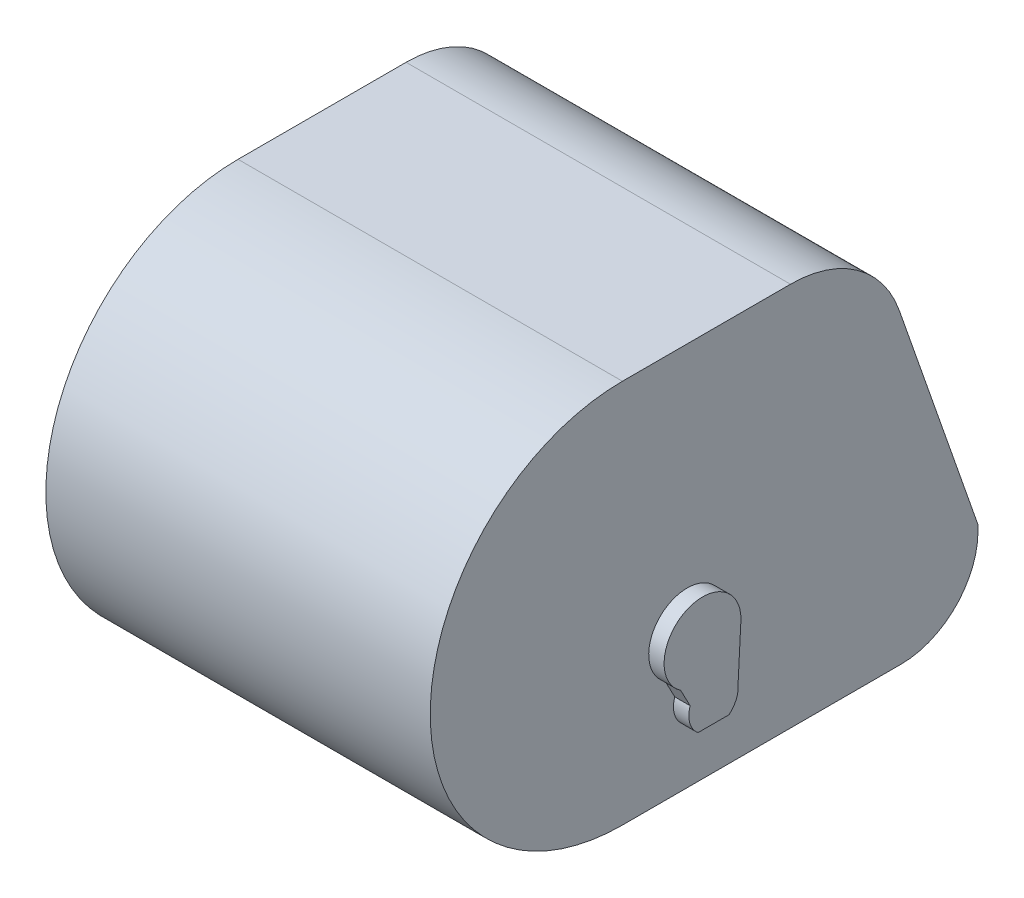
from build123d import *

# Parameters (mm, degrees)
BOSS_EXTRUDE1_DEPTH      = 50
BOSS_EXTRUDE1_DEPTH_BACK = 50
FILLET1_R                = 30
BOSS_EXTRUDE2_DEPTH      = 4
FILLET4_R                = 20


with BuildPart() as part:
    # Sketch1 → Boss-Extrude1 (new, two sides: drawn at the far end of the back side and taken through both)
    with BuildSketch(Plane(origin=(0, 0, 0), x_dir=(0, 0, -1), z_dir=(1, 0, 0)).offset(-BOSS_EXTRUDE1_DEPTH_BACK)):
        with BuildLine():
            Line((67.5, -28.571428571), (40, 50))
            Line((40, 50), (-25.000000097, 50))
            ThreePointArc((-25.000000097, 50), (-75, -6.7e-08), (-24.999999963, -50))
            Line((-24.999999963, -50), (67.5, -50))
            Line((67.5, -50), (67.5, -28.571428571))
        make_face()
    extrude(amount=BOSS_EXTRUDE1_DEPTH + BOSS_EXTRUDE1_DEPTH_BACK)

    # Fillet1
    fillet1_edges = [part.edges().sort_by_distance(p)[0] for p in [
        (0, 50, -40),
    ]]
    fillet(fillet1_edges, radius=FILLET1_R)

    # Sketch6 → Boss-Extrude2 (add)
    with BuildSketch(Plane(origin=(50, 0, 0), x_dir=(0, 0, -1), z_dir=(1, 0, 0))):
        with BuildLine():
            Line((-13.846677423, -23.22770462), (-11.38303259, -27.92393056))
            ThreePointArc((-11.38303259, -27.92393056), (-11.474733065, -31.785574712), (-9.332730592, -35))
            Line((-9.332730592, -35), (-1.291867628, -35))
            ThreePointArc((-1.291867628, -35), (0.59665296, -32.49963092), (1.075777558, -29.403052943))
            Line((1.075777558, -29.403052943), (1.837060492, -15))
            ThreePointArc((1.837060492, -15), (-12.80850841, -6.144567228), (-13.846677423, -23.22770462))
        make_face()
    boss_extrude2 = extrude(amount=BOSS_EXTRUDE2_DEPTH)

    # Mirror2: Boss-Extrude2 across plane
    add(boss_extrude2.mirror(Plane(origin=(0, 0, 0), x_dir=(0, 0, 1), z_dir=(1, 0, 0))))

    # Fillet4
    fillet4_edges = [part.edges().sort_by_distance(p)[0] for p in [
        (0, -50, -67.5),
    ]]
    fillet(fillet4_edges, radius=FILLET4_R)


solid = part.part
